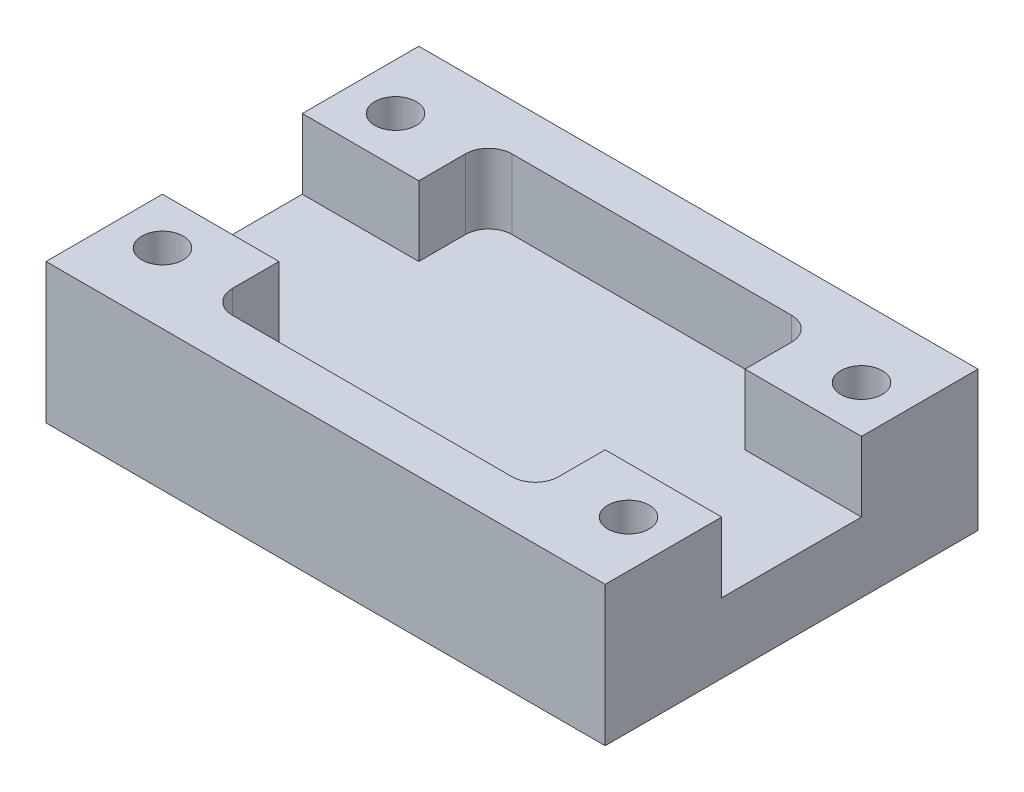
from build123d import *

# Parameters (mm, degrees)
SKETCH1_W           = 24
SKETCH1_H           = 16
BOSS_EXTRUDE1_DEPTH = 6
SKETCH2_W           = 5
SKETCH2_H           = 6
SKETCH2_W_2         = 14
SKETCH2_H_2         = 12
CUT_EXTRUDE1_DEPTH  = 3
FILLET1_R           = 1
SKETCH3_R           = 0.889
CUT_EXTRUDE2_DEPTH  = 16.620499352


with BuildPart() as part:
    # Sketch1 → Boss-Extrude1 (new body)
    with BuildSketch(Plane(origin=(0, 0, 0), x_dir=(1, 0, 0), z_dir=(0, 1, 0))):
        Rectangle(SKETCH1_W, SKETCH1_H)
    extrude(amount=BOSS_EXTRUDE1_DEPTH)

    # Sketch2 → Cut-Extrude1 (cut)
    with BuildSketch(Plane(origin=(0, 6, 0), x_dir=(1, 0, 0), z_dir=(0, 1, 0))):
        with Locations((-9.5, 0)):
            Rectangle(SKETCH2_W, SKETCH2_H)
        Rectangle(SKETCH2_W_2, SKETCH2_H_2)
        with Locations((9.5, 0)):
            Rectangle(SKETCH2_W, SKETCH2_H)
    extrude(amount=-CUT_EXTRUDE1_DEPTH, mode=Mode.SUBTRACT)

    # Fillet1
    fillet1_edges = [part.edges().sort_by_distance(p)[0] for p in [
        (-7, 4.5, -6),
        (7, 4.5, -6),
        (7, 4.5, 6),
        (-7, 4.5, 6),
    ]]
    fillet(fillet1_edges, radius=FILLET1_R)

    # Sketch3 → Cut-Extrude2 (cut, through all)
    with BuildSketch(Plane(origin=(0, 6, 0), x_dir=(1, 0, 0), z_dir=(0, 1, 0))):
        with Locations(Location((-10, 5, 0), (0, 0, 270))):
            Circle(SKETCH3_R)
        with Locations(Location((-10, -5, 0), (0, 0, 270))):
            Circle(SKETCH3_R)
        with Locations(Location((10, -5, 0), (0, 0, 270))):
            Circle(SKETCH3_R)
        with Locations(Location((10, 5, 0), (0, 0, 270))):
            Circle(SKETCH3_R)
    extrude(amount=-CUT_EXTRUDE2_DEPTH, mode=Mode.SUBTRACT)


solid = part.part
